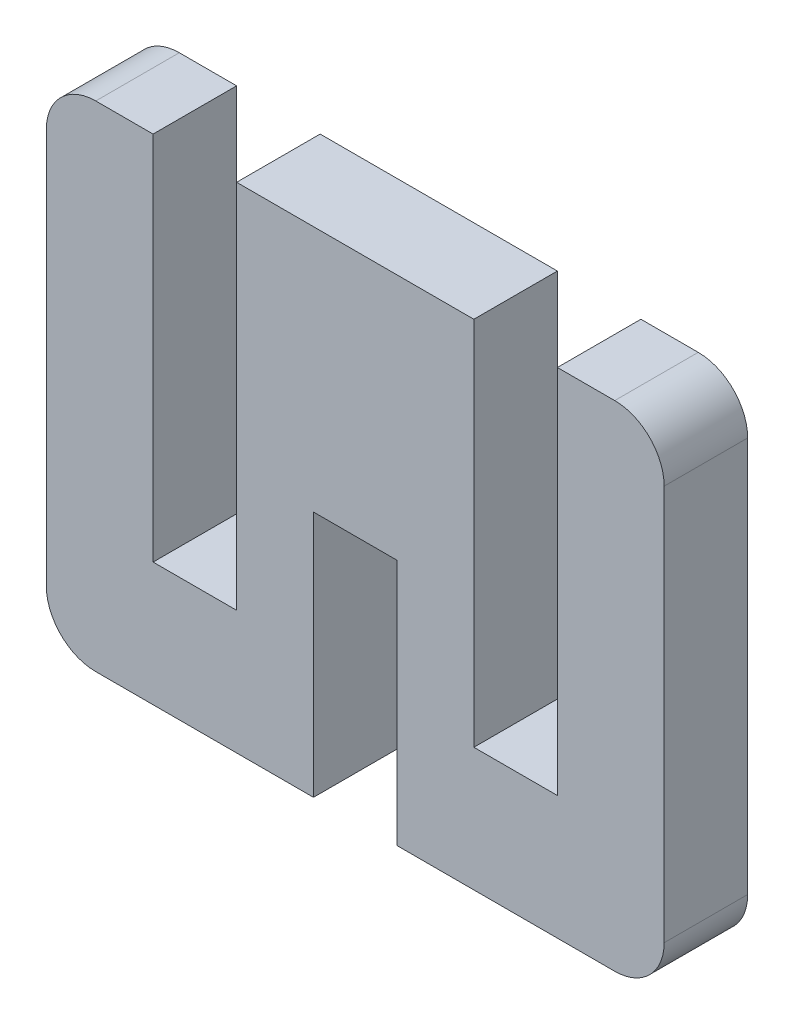
from build123d import *

# Parameters (mm, degrees)
SKETCH1_W           = 31.75
SKETCH1_H           = 25.4
BOSS_EXTRUDE1_DEPTH = 4.2926
FILLET1_R           = 2.54
SKETCH2_W           = 4.2926
SKETCH2_H           = 19.05
SKETCH2_H_2         = 12.7
CUT_EXTRUDE2_DEPTH  = 4.2926


with BuildPart() as part:
    # Sketch1 → Boss-Extrude1 (new body)
    with BuildSketch(Plane.XY):
        Rectangle(SKETCH1_W, SKETCH1_H)
    extrude(amount=BOSS_EXTRUDE1_DEPTH)

    # Fillet1
    fillet1_edges = [part.edges().sort_by_distance(p)[0] for p in [
        (15.875, -12.7, 2.1463),
        (-15.875, -12.7, 2.1463),
        (-15.875, 12.7, 2.1463),
        (15.875, 12.7, 2.1463),
    ]]
    fillet(fillet1_edges, radius=FILLET1_R)

    # Sketch2 → Cut-Extrude2 (cut)
    with BuildSketch(Plane.XY.offset(4.2926)):
        with Locations((-8.2423, 3.175)):
            Rectangle(SKETCH2_W, SKETCH2_H)
        with Locations((8.2423, 3.175)):
            Rectangle(SKETCH2_W, SKETCH2_H)
        with Locations((0, -6.35)):
            Rectangle(SKETCH2_W, SKETCH2_H_2)
    extrude(amount=-CUT_EXTRUDE2_DEPTH, mode=Mode.SUBTRACT)


solid = part.part
